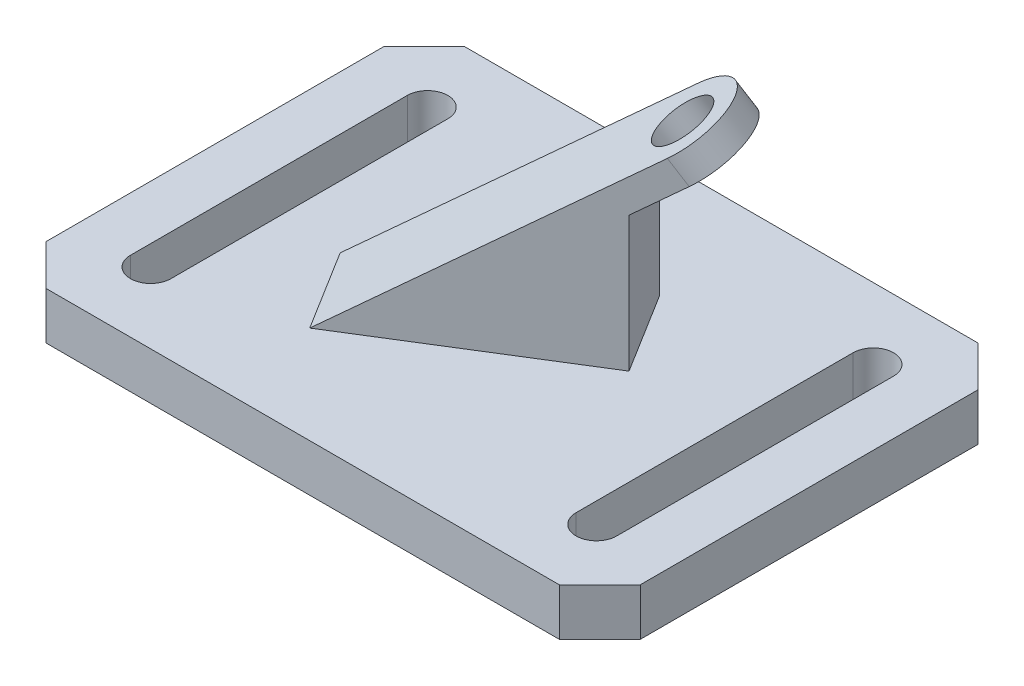
from build123d import *

# Parameters (mm, degrees)
BOSS_EXTRUDE2_DEPTH            = 7
BOSS_EXTRUDE3_DEPTH            = 7
CUT_EXTRUDE1_REACH             = 70.972
SKETCH6_R                      = 4
CUT_EXTRUDE1_DIRECTION_2_DEPTH = 69.971984668


with BuildPart() as part:
    # Sketch1 → Boss-Extrude2 (new body)
    with BuildSketch(Plane(origin=(0, 0, 0), x_dir=(1, 0, 0), z_dir=(0, 1, 0))):
        Polygon((-38, 31), (38, 31), (44, 25), (44, -25), (38, -31), (-38, -31), (-44, -25), (-44, 25), align=None)
        with BuildLine():
            ThreePointArc((30, -20.5), (33, -23.5), (36, -20.5))
            Line((36, -20.5), (36, 20.5))
            ThreePointArc((36, 20.5), (33, 23.5), (30, 20.5))
            Line((30, 20.5), (30, -20.5))
        make_face(mode=Mode.SUBTRACT)
        with BuildLine():
            Line((-30, 20.5), (-30, -20.5))
            ThreePointArc((-30, -20.5), (-33, -23.5), (-36, -20.5))
            Line((-36, -20.5), (-36, 20.5))
            ThreePointArc((-36, 20.5), (-33, 23.5), (-30, 20.5))
        make_face(mode=Mode.SUBTRACT)
    extrude(amount=BOSS_EXTRUDE2_DEPTH)

    # Sketch4 → Boss-Extrude3 (add, symmetric)
    with BuildSketch(Plane(origin=(0, 0, 0), x_dir=(0.8494412510349073, 0, -0.5276832014004726), z_dir=(0.5276832014004726, 0, 0.8494412510349073))):
        Polygon((-20.114072918, 7), (24.811902859, 39.640632014), (27.163043869, 36.404564037), (14.218771959, 27), (14.218771959, 7), align=None)
    extrude(amount=BOSS_EXTRUDE3_DEPTH, both=True)

    # Sketch6 → Cut-Extrude1 (cut, up to next)
    with BuildSketch(Plane(origin=(-8.730505436, 14.146369539, 5.423495801), x_dir=(0.8664354877824213, 0.4662012627589443, 0.17873423878262298), z_dir=(-0.4992890400471834, 0.8090169943749506, 0.31016440366567455)), mode=Mode.PRIVATE) as cut_extrude1_sk1:
        with Locations(Location((28.056399261, 21.543398247, 0), (0, 0, 10.836448225))):
            Circle(SKETCH6_R)
    cut_extrude1_tool1 = extrude(cut_extrude1_sk1.sketch, amount=-CUT_EXTRUDE1_REACH, mode=Mode.PRIVATE) & part.part
    # Sketch6 → Cut-Extrude1 (cut, up to next)
    with BuildSketch(Plane(origin=(-8.730505436, 14.146369539, 5.423495801), x_dir=(0.8664354877824213, 0.4662012627589443, 0.17873423878262298), z_dir=(-0.4992890400471834, 0.8090169943749506, 0.31016440366567455)), mode=Mode.PRIVATE) as cut_extrude1_sk2:
        with BuildLine():
            ThreePointArc((23.793205434, 27.09544097), (31.151366403, 27.82202695), (35.056399261, 21.543398247))
            ThreePointArc((35.056399261, 21.543398247), (34.335027943, 18.448431062), (32.31959301, 15.991355465))
            Line((32.31959301, 15.991355465), (38.664784769, 20.863577012))
            Line((38.664784769, 20.863577012), (30.138397146, 31.967662481))
            Line((30.138397146, 31.967662481), (23.793205434, 27.09544097))
        make_face()
    cut_extrude1_tool2 = extrude(cut_extrude1_sk2.sketch, amount=-CUT_EXTRUDE1_REACH, mode=Mode.PRIVATE) & part.part
    add(cut_extrude1_tool1.solids().sort_by_distance((15.578555, 34.93835, -9.677587))[0], mode=Mode.SUBTRACT)
    add(cut_extrude1_tool2.solids().sort_by_distance((18.343759, 38.743909, -15.152507))[0], mode=Mode.SUBTRACT)

    # Sketch6 → Cut-Extrude1 direction 2 (cut)
    with BuildSketch(Plane(origin=(-8.730505436, 14.146369539, 5.423495801), x_dir=(0.8664354877824213, 0.4662012627589443, 0.17873423878262298), z_dir=(-0.4992890400471834, 0.8090169943749506, 0.31016440366567455))):
        with Locations(Location((28.056399261, 21.543398247, 0), (0, 0, 10.836448225))):
            Circle(SKETCH6_R)
        with BuildLine():
            ThreePointArc((23.793205434, 27.09544097), (31.151366403, 27.82202695), (35.056399261, 21.543398247))
            ThreePointArc((35.056399261, 21.543398247), (34.335027943, 18.448431062), (32.31959301, 15.991355465))
            Line((32.31959301, 15.991355465), (38.664784769, 20.863577012))
            Line((38.664784769, 20.863577012), (30.138397146, 31.967662481))
            Line((30.138397146, 31.967662481), (23.793205434, 27.09544097))
        make_face()
    extrude(amount=CUT_EXTRUDE1_DIRECTION_2_DEPTH, mode=Mode.SUBTRACT)


solid = part.part
